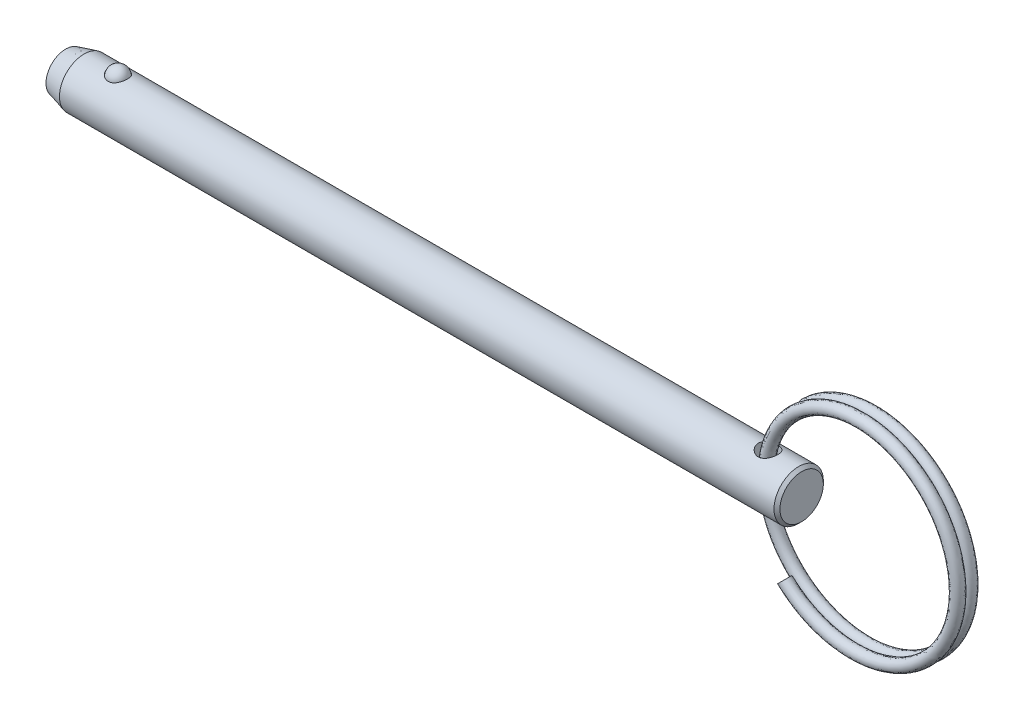
from build123d import *

# Parameters (mm, degrees)
SKETCH4_W          = 1.27
SKETCH4_H          = 6.35
SWEEP1_PITCH       = 1.5494
SWEEP1_HEIGHT      = 1.355725
SWEEP1_RADIUS      = 13.462
SKETCH6_R          = 0.762
SWEEP2_PITCH       = 1.5494
SWEEP2_HEIGHT      = 1.355725
SWEEP2_RADIUS      = 13.462
SWEEP2_START_ANGLE = -180
SKETCH6_2_R        = 0.762


with BuildPart() as part:
    # Sketch1 → Revolve1 (revolve)
    with BuildSketch(Plane.XY, mode=Mode.PRIVATE) as revolve1_sk:
        Polygon((5.588, 2.794), (5.207, 3.175), (-86.834947737, 3.175), (-89.2048, 2.54), (-89.2048, 0), (5.588, 0), align=None)
    revolve(revolve1_sk.sketch.rotate(Axis((5.588, 0, 0), (1, 0, 0)), 90), axis=Axis((5.588, 0, 0), (1, 0, 0)))

    # Sketch2 → Cut-Revolve1 (revolve, cut)
    with BuildSketch(Plane.XY):
        with BuildLine():
            Line((-81.212982051, 2.8575), (-83.727582051, 2.8575))
            ThreePointArc((-83.727582051, 2.8575), (-82.470282051, 4.1148), (-81.212982051, 2.8575))
        make_face()
    revolve(axis=Axis((-81.212982051, 2.8575, 0), (1, 0, 0)), mode=Mode.SUBTRACT)

    # Sketch4 → Cut-Revolve2 (revolve, cut)
    with BuildSketch(Plane.XY, mode=Mode.PRIVATE) as cut_revolve2_sk:
        with Locations((1.905, 0)):
            Rectangle(SKETCH4_W, SKETCH4_H)
    revolve(cut_revolve2_sk.sketch.rotate(Axis((1.27, -3.175, 0), (0, 1, 0)), 90), axis=Axis((1.27, -3.175, 0), (0, 1, 0)), mode=Mode.SUBTRACT)


with BuildPart() as body_2:
    # Sketch3 → Revolve2 (revolve)
    with BuildSketch(Plane.XY):
        with BuildLine():
            Line((-81.238382051, 2.8575), (-83.702182051, 2.8575))
            ThreePointArc((-83.702182051, 2.8575), (-82.470282051, 4.0894), (-81.238382051, 2.8575))
        make_face()
    revolve(axis=Axis((-81.238382051, 2.8575, 0), (1, 0, 0)))


with BuildPart() as body_3:
    # Sweep1: sweep along a helix
    with BuildLine() as sweep1_path:
        Helix(SWEEP1_PITCH, SWEEP1_HEIGHT, SWEEP1_RADIUS, center=(13.755025091, 0, 0), direction=(0, 0, -1), lefthand=True)
    # Sketch6 → Sweep1 (sweep)
    with BuildSketch(Plane(origin=(114.003847968, 0, 0), x_dir=(0, 0, -1), z_dir=(0, 1, 0))):
        with Locations((0, 112.948822877)):
            Circle(SKETCH6_R)
    sweep(path=sweep1_path.line, is_frenet=True)

    # Sweep2: sweep along a helix
    with BuildLine() as sweep2_path:
        add(Helix(SWEEP2_PITCH, SWEEP2_HEIGHT, SWEEP2_RADIUS, center=(13.755025091, 0, 0), direction=(0, 0, 1), lefthand=True, mode=Mode.PRIVATE).rotate(Axis((13.755025091, 0, 0), (0, 0, 1)), SWEEP2_START_ANGLE))
    # Sketch6<2> → Sweep2 (sweep)
    with BuildSketch(Plane(origin=(114.003847968, 0, 0), x_dir=(0, 0, -1), z_dir=(0, 1, 0))):
        with Locations((0, 112.948822877)):
            Circle(SKETCH6_2_R)
    sweep(path=sweep2_path.line, is_frenet=True)


solid = Compound([part.part, body_2.part, body_3.part])
